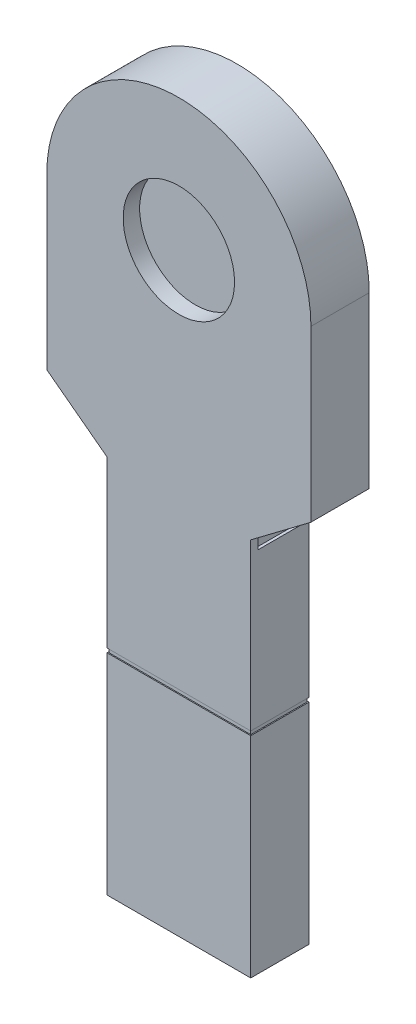
from build123d import *

# Parameters (mm, degrees)
EXTRUDE_1_DEPTH     = 45
SKETCH_2_R          = 43
CUT_EXTRUDE_1_DEPTH = 12.7
CUT_EXTRUDE_6_DEPTH = 33.5
SKETCH_6_W          = 0.8
SKETCH_6_H          = 3.2


with BuildPart() as part:
    # Эскиз1 → Бобышка-Вытянуть1 (new body)
    with BuildSketch(Plane.XY):
        with BuildLine():
            Line((-102, 0), (-102, -131))
            Line((-102, -131), (-55.5, -166.04026333))
            Line((-55.5, -166.04026333), (-55.5, -459.04026333))
            Line((-55.5, -459.04026333), (55.5, -459.04026333))
            Line((55.5, -459.04026333), (55.5, -166.04026333))
            Line((55.5, -166.04026333), (102, -131))
            Line((102, -131), (102, 0))
            ThreePointArc((102, 0), (0, 102), (-102, 0))
        make_face()
    extrude(amount=EXTRUDE_1_DEPTH)

    # Эскиз2 → Вырез-Вытянуть1 (cut)
    with BuildSketch(Plane.XY.offset(45)):
        Circle(SKETCH_2_R)
    extrude(amount=-CUT_EXTRUDE_1_DEPTH, mode=Mode.SUBTRACT)

    # Sketch 1 2 → Вырез-Вытянуть6 (cut)
    with BuildSketch(Plane(origin=(91.857329022, -138.643050794, 39.25), x_dir=(-0.7228095146046781, -0.6910473251499855, 0), z_dir=(0, 0, -1))):
        Polygon((0, 0), (45.212193782, 5.321669076), (51.742831193, -1.509132064), (53.321326579, 0), (39.707694274, 14.239347438), (-1.110524428, 9.43486807), align=None)
    cut_extrude_6 = extrude(amount=CUT_EXTRUDE_6_DEPTH, mode=Mode.SUBTRACT)

    # Зеркальное отражение1: Вырез-Вытянуть6 across plane
    add(cut_extrude_6.mirror(Plane(origin=(0, 0, 0), x_dir=(0, 0, 1), z_dir=(1, 0, 0))), mode=Mode.SUBTRACT)

    # Вырез-По траектории1: sweep along a curve in space
    with BuildLine() as sweep_1_path:
        Line((55.5, -295.44026333, 45), (55.5, -295.44026333, 0))
        Line((55.5, -295.44026333, 0), (-55.5, -295.44026333, 0))
        Line((-55.5, -295.44026333, 0), (-55.5, -295.44026333, 45))
        Line((-55.5, -295.44026333, 45), (55.5, -295.44026333, 45))
    # Эскиз6 → Вырез-По траектории1 (sweep, cut)
    with BuildSketch(Plane.XY.offset(45)):
        with Locations((55.1, -295.44026333)):
            Rectangle(SKETCH_6_W, SKETCH_6_H)
    sweep(path=sweep_1_path.line, transition=Transition.RIGHT, mode=Mode.SUBTRACT)


solid = part.part
